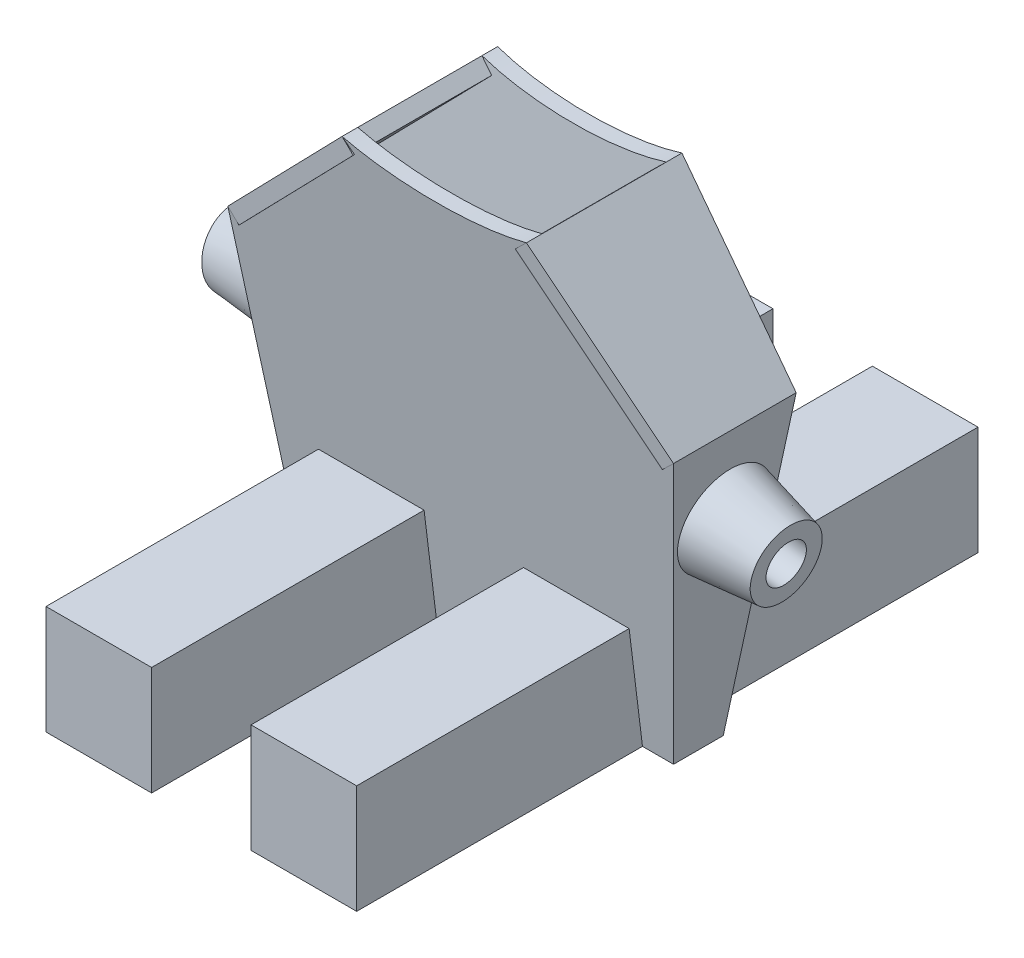
from build123d import *

# Parameters (mm, degrees)
SKETCH1_W                = 12
SKETCH1_H                = 1.6
BOSS_EXTRUDE1_DEPTH      = 15
BOSS_EXTRUDE1_TAPER      = -7
SHELL1_T                 = -0.5
SKETCH6_W                = 3.4
SKETCH6_H                = 20
BOSS_EXTRUDE2_DEPTH      = 3.5
BOSS_EXTRUDE2_2_DEPTH    = 3.5
CUT_EXTRUDE11_DEPTH      = 10
CUT_EXTRUDE11_DEPTH_BACK = 10
SKETCH11_RX              = 4.5
SKETCH11_RY              = 1.5
CUT_EXTRUDE12_DEPTH      = 10
BOSS_EXTRUDE3_DEPTH      = 0.5
SKETCH30_W               = 3.2
SKETCH30_H               = 1.6
BOSS_EXTRUDE6_DEPTH      = 9
BOSS_EXTRUDE6_TAPER      = -6
SKETCH31_R               = 1.504583892
BOSS_EXTRUDE7_DEPTH      = 2
BOSS_EXTRUDE7_TAPER      = 10
SKETCH32_R               = 0.64546473
CUT_EXTRUDE13_DEPTH      = 4


with BuildPart() as part:
    # Sketch1 → Boss-Extrude1 (new body)
    with BuildSketch(Plane(origin=(0, 0, 0), x_dir=(1, 0, 0), z_dir=(0, 1, 0))):
        Rectangle(SKETCH1_W, SKETCH1_H)
    extrude(amount=BOSS_EXTRUDE1_DEPTH, taper=BOSS_EXTRUDE1_TAPER)

    # Shell1
    shell1_openings = [part.faces().sort_by_distance(p)[0] for p in [
        (0, 15, 0),
    ]]
    offset(amount=SHELL1_T, openings=shell1_openings, kind=Kind.INTERSECTION)

    # Sketch11 → Cut-Extrude11 (cut, two sides: drawn at the far end of the back side and taken through both)
    with BuildSketch(Plane.XY.offset(-CUT_EXTRUDE11_DEPTH_BACK)):
        with Locations((0, 15)):
            Ellipse(SKETCH11_RX, SKETCH11_RY)
    extrude(amount=CUT_EXTRUDE11_DEPTH + CUT_EXTRUDE11_DEPTH_BACK, mode=Mode.SUBTRACT)

    # Sketch18 → Cut-Extrude12 (cut, symmetric)
    with BuildSketch(Plane.XY):
        Polygon((-2.966549011, 13.872092056), (-7.173702506, 9.559039808), (-8.984967274, 15.813419698), (-2.966549011, 15.813419698), align=None)
    cut_extrude12 = extrude(amount=CUT_EXTRUDE12_DEPTH, both=True, mode=Mode.SUBTRACT)

    # Sketch19 → Boss-Extrude3 (add)
    with BuildSketch(Plane(origin=(-8.45404379, 8.246470904, 0), x_dir=(0, 0, 1), z_dir=(-0.7158402135047951, 0.6982641253346826, 0))):
        Polygon((1.973702506, 1.833605992), (2.503278732, 7.858766589), (-2.503278732, 7.858766589), (-1.973702506, 1.833605992), align=None)
    boss_extrude3 = extrude(amount=-BOSS_EXTRUDE3_DEPTH)

    # Mirror3: Boss-Extrude3 across plane
    add(boss_extrude3.mirror(Plane(origin=(0, 0, 0), x_dir=(0, 0, 1), z_dir=(1, 0, 0))))



with BuildPart() as body_2:
    # Sketch6 → Boss-Extrude2 (new body)
    with BuildSketch(Plane.XZ):
        with Locations((-3.3, 0)):
            Rectangle(SKETCH6_W, SKETCH6_H)
    extrude(amount=-BOSS_EXTRUDE2_DEPTH)


with BuildPart() as body_3:
    # Sketch6 → Boss-Extrude2 2 (new body)
    with BuildSketch(Plane.XZ):
        with Locations((3.3, 0)):
            Rectangle(SKETCH6_W, SKETCH6_H)
    extrude(amount=-BOSS_EXTRUDE2_2_DEPTH)


with BuildPart() as part_1:
    add(part.part)

    add(body_2.part)  # Boss-Extrude6 merges body 2

    add(body_3.part)  # Boss-Extrude6 merges body 3
    # Sketch30 → Boss-Extrude6 (add)
    with BuildSketch(Plane.XZ):
        Rectangle(SKETCH30_W, SKETCH30_H)
    extrude(amount=-BOSS_EXTRUDE6_DEPTH, taper=BOSS_EXTRUDE6_TAPER)

    # Mirror7: Cut-Extrude12 across plane
    add(cut_extrude12.mirror(Plane(origin=(0, 0, 0), x_dir=(0, 0, 1), z_dir=(1, 0, 0))), mode=Mode.SUBTRACT)

    # Sketch31 → Boss-Extrude7 (add)
    with BuildSketch(Plane(origin=(5.910887179, -0.725765687, 0), x_dir=(0, 0, -1), z_dir=(0.992546151641322, -0.12186934340514774, 0))):
        with Locations((0, 7.63302961)):
            Circle(SKETCH31_R)
    boss_extrude7 = extrude(amount=BOSS_EXTRUDE7_DEPTH, taper=BOSS_EXTRUDE7_TAPER)

    # Mirror8: Boss-Extrude7 across plane
    add(boss_extrude7.mirror(Plane(origin=(0, 0, 0), x_dir=(0, 0, 1), z_dir=(1, 0, 0))))

    # Sketch32 → Cut-Extrude13 (cut)
    with BuildSketch(Plane(origin=(7.895979482, -0.969504374, 0), x_dir=(0, 0, -1), z_dir=(0.992546151641322, -0.12186934340514774, 0))):
        with Locations((0, 7.63302961)):
            Circle(SKETCH32_R)
    cut_extrude13 = extrude(amount=-CUT_EXTRUDE13_DEPTH, mode=Mode.SUBTRACT)

    # Mirror9: Cut-Extrude13 across plane
    add(cut_extrude13.mirror(Plane(origin=(0, 0, 0), x_dir=(0, 0, 1), z_dir=(1, 0, 0))), mode=Mode.SUBTRACT)


solid = part_1.part
